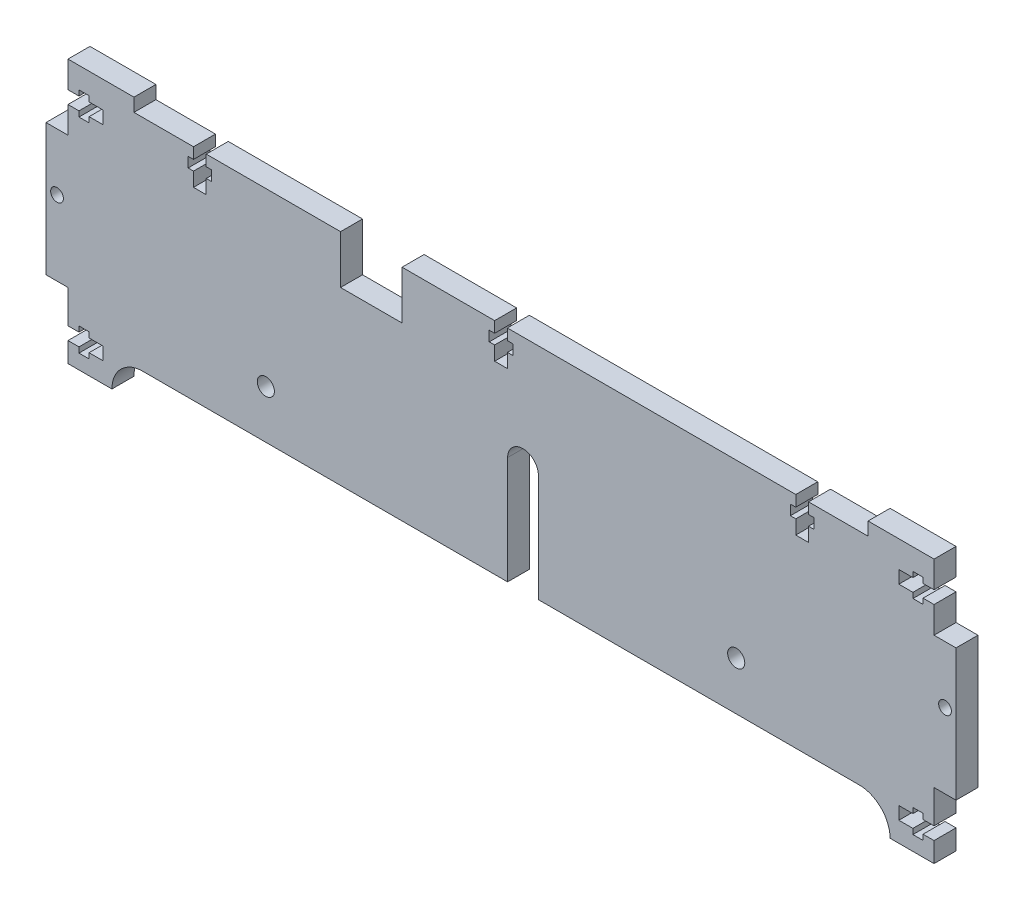
from build123d import *

# Parameters (mm, degrees)
BOSS_EXTRUDE1_DEPTH = 5
SKETCH2_W           = 14
SKETCH2_H           = 12
CUT_EXTRUDE1_DEPTH  = 116.491341667
SKETCH3_R           = 3.5
SKETCH3_W           = 7
SKETCH3_H           = 24.5
CUT_EXTRUDE2_DEPTH  = 116.491341667
SKETCH4_R           = 1.45
SKETCH4_W           = 8
SKETCH4_H           = 2.9
SKETCH4_W_2         = 2.3
SKETCH4_H_2         = 5.35
SKETCH4_W_3         = 2.9
SKETCH4_H_3         = 8
SKETCH4_W_4         = 5.35
SKETCH4_H_4         = 2.3
CUT_EXTRUDE3_DEPTH  = 116.491341667
SKETCH5_R           = 1.95
CUT_EXTRUDE4_DEPTH  = 116.491341667


with BuildPart() as part:
    # Sketch1 → Boss-Extrude1 (new body)
    with BuildSketch(Plane.XY):
        with BuildLine():
            Line((-83.5, 48), (-83.5, 51))
            Line((-83.5, 51), (-98.5, 51))
            Line((-98.5, 51), (-98.5, 44.95))
            Line((-98.5, 44.95), (-96, 44.95))
            Line((-96, 44.95), (-96, 46.175))
            Line((-96, 46.175), (-93.7, 46.175))
            Line((-93.7, 46.175), (-93.7, 44.95))
            Line((-93.7, 44.95), (-90.5, 44.95))
            Line((-90.5, 44.95), (-90.5, 42.05))
            Line((-90.5, 42.05), (-93.7, 42.05))
            Line((-93.7, 42.05), (-93.7, 40.825))
            Line((-93.7, 40.825), (-96, 40.825))
            Line((-96, 40.825), (-96, 42.05))
            Line((-96, 42.05), (-98.5, 42.05))
            Line((-98.5, 42.05), (-98.5, 36))
            Line((-98.5, 36), (-103.5, 36))
            Line((-103.5, 36), (-103.5, 6))
            Line((-103.5, 6), (-98.5, 6))
            Line((-98.5, 6), (-98.5, -1.55))
            Line((-98.5, -1.55), (-96, -1.55))
            Line((-96, -1.55), (-96, -0.325))
            Line((-96, -0.325), (-93.7, -0.325))
            Line((-93.7, -0.325), (-93.7, -1.55))
            Line((-93.7, -1.55), (-90.5, -1.55))
            Line((-90.5, -1.55), (-90.5, -4.45))
            Line((-90.5, -4.45), (-93.7, -4.45))
            Line((-93.7, -4.45), (-93.7, -5.675))
            Line((-93.7, -5.675), (-96, -5.675))
            Line((-96, -5.675), (-96, -4.45))
            Line((-96, -4.45), (-98.5, -4.45))
            Line((-98.5, -4.45), (-98.5, -9))
            Line((-98.5, -9), (-88.5, -9))
            ThreePointArc((-88.5, -9), (-86.449747468, -4.050252532), (-81.5, -2))
            Line((-81.5, -2), (81.5, -2))
            ThreePointArc((81.5, -2), (86.449747468, -4.050252532), (88.5, -9))
            Line((88.5, -9), (98.5, -9))
            Line((98.5, -9), (98.5, -4.45))
            Line((98.5, -4.45), (96, -4.45))
            Line((96, -4.45), (96, -5.675))
            Line((96, -5.675), (93.7, -5.675))
            Line((93.7, -5.675), (93.7, -4.45))
            Line((93.7, -4.45), (90.5, -4.45))
            Line((90.5, -4.45), (90.5, -1.55))
            Line((90.5, -1.55), (93.7, -1.55))
            Line((93.7, -1.55), (93.7, -0.325))
            Line((93.7, -0.325), (96, -0.325))
            Line((96, -0.325), (96, -1.55))
            Line((96, -1.55), (98.5, -1.55))
            Line((98.5, -1.55), (98.5, 6))
            Line((98.5, 6), (103.5, 6))
            Line((103.5, 6), (103.5, 36))
            Line((103.5, 36), (98.5, 36))
            Line((98.5, 36), (98.5, 42.05))
            Line((98.5, 42.05), (96, 42.05))
            Line((96, 42.05), (96, 40.825))
            Line((96, 40.825), (93.7, 40.825))
            Line((93.7, 40.825), (93.7, 42.05))
            Line((93.7, 42.05), (90.5, 42.05))
            Line((90.5, 42.05), (90.5, 44.95))
            Line((90.5, 44.95), (93.7, 44.95))
            Line((93.7, 44.95), (93.7, 46.175))
            Line((93.7, 46.175), (96, 46.175))
            Line((96, 46.175), (96, 44.95))
            Line((96, 44.95), (98.5, 44.95))
            Line((98.5, 44.95), (98.5, 51))
            Line((98.5, 51), (83.5, 51))
            Line((83.5, 51), (83.5, 48))
            Line((83.5, 48), (69.95, 48))
            Line((69.95, 48), (69.95, 45.5))
            Line((69.95, 45.5), (71.175, 45.5))
            Line((71.175, 45.5), (71.175, 43.2))
            Line((71.175, 43.2), (69.95, 43.2))
            Line((69.95, 43.2), (69.95, 40))
            Line((69.95, 40), (67.05, 40))
            Line((67.05, 40), (67.05, 43.2))
            Line((67.05, 43.2), (65.825, 43.2))
            Line((65.825, 43.2), (65.825, 45.5))
            Line((65.825, 45.5), (67.05, 45.5))
            Line((67.05, 45.5), (67.05, 48))
            Line((67.05, 48), (1.45, 48))
            Line((1.45, 48), (1.45, 45.5))
            Line((1.45, 45.5), (2.675, 45.5))
            Line((2.675, 45.5), (2.675, 43.2))
            Line((2.675, 43.2), (1.45, 43.2))
            Line((1.45, 43.2), (1.45, 40))
            Line((1.45, 40), (-1.45, 40))
            Line((-1.45, 40), (-1.45, 43.2))
            Line((-1.45, 43.2), (-2.675, 43.2))
            Line((-2.675, 43.2), (-2.675, 45.5))
            Line((-2.675, 45.5), (-1.45, 45.5))
            Line((-1.45, 45.5), (-1.45, 48))
            Line((-1.45, 48), (-67.05, 48))
            Line((-67.05, 48), (-67.05, 45.5))
            Line((-67.05, 45.5), (-65.825, 45.5))
            Line((-65.825, 45.5), (-65.825, 43.2))
            Line((-65.825, 43.2), (-67.05, 43.2))
            Line((-67.05, 43.2), (-67.05, 40))
            Line((-67.05, 40), (-69.95, 40))
            Line((-69.95, 40), (-69.95, 43.2))
            Line((-69.95, 43.2), (-71.175, 43.2))
            Line((-71.175, 43.2), (-71.175, 45.5))
            Line((-71.175, 45.5), (-69.95, 45.5))
            Line((-69.95, 45.5), (-69.95, 48))
            Line((-69.95, 48), (-83.5, 48))
        make_face()
    extrude(amount=BOSS_EXTRUDE1_DEPTH)

    # Sketch2 → Cut-Extrude1 (cut, through all)
    with BuildSketch(Plane.XY.offset(5)):
        with Locations((-29.5, 43)):
            Rectangle(SKETCH2_W, SKETCH2_H)
    extrude(amount=-CUT_EXTRUDE1_DEPTH, mode=Mode.SUBTRACT)

    # Sketch3 → Cut-Extrude2 (cut, through all)
    with BuildSketch(Plane.XY.offset(5)):
        with Locations((5, 22.5)):
            Circle(SKETCH3_R)
        with Locations((5, 10.25)):
            Rectangle(SKETCH3_W, SKETCH3_H)
    extrude(amount=-CUT_EXTRUDE2_DEPTH, mode=Mode.SUBTRACT)

    # Sketch4 → Cut-Extrude3 (cut, through all)
    with BuildSketch(Plane.XY.offset(5)):
        with Locations((-101, 23)):
            Circle(SKETCH4_R)
        with Locations(Location((101, 23, 0), (0, 0, 180))):
            Circle(SKETCH4_R)
        with Locations((-94.5, 43.5)):
            Rectangle(SKETCH4_W, SKETCH4_H)
        with Locations((-94.85, 43.5)):
            Rectangle(SKETCH4_W_2, SKETCH4_H_2)
        with Locations((-94.5, -3)):
            Rectangle(SKETCH4_W, SKETCH4_H)
        with Locations((-94.85, -3)):
            Rectangle(SKETCH4_W_2, SKETCH4_H_2)
        with Locations((94.85, -3)):
            Rectangle(SKETCH4_W_2, SKETCH4_H_2)
        with Locations((94.5, -3)):
            Rectangle(SKETCH4_W, SKETCH4_H)
        with Locations((94.85, 43.5)):
            Rectangle(SKETCH4_W_2, SKETCH4_H_2)
        with Locations((94.5, 43.5)):
            Rectangle(SKETCH4_W, SKETCH4_H)
        with Locations((-68.5, 44)):
            Rectangle(SKETCH4_W_3, SKETCH4_H_3)
        with Locations((-68.5, 44.35)):
            Rectangle(SKETCH4_W_4, SKETCH4_H_4)
        with Locations((0, 44)):
            Rectangle(SKETCH4_W_3, SKETCH4_H_3)
        with Locations((0, 44.35)):
            Rectangle(SKETCH4_W_4, SKETCH4_H_4)
        with Locations((68.5, 44.35)):
            Rectangle(SKETCH4_W_4, SKETCH4_H_4)
        with Locations((68.5, 44)):
            Rectangle(SKETCH4_W_3, SKETCH4_H_3)
    extrude(amount=-CUT_EXTRUDE3_DEPTH, mode=Mode.SUBTRACT)

    # Sketch5 → Cut-Extrude4 (cut, through all)
    with BuildSketch(Plane.XY.offset(5)):
        with Locations((-53.5, 9)):
            Circle(SKETCH5_R)
        with Locations((53.5, 9)):
            Circle(SKETCH5_R)
    extrude(amount=-CUT_EXTRUDE4_DEPTH, mode=Mode.SUBTRACT)


solid = part.part
